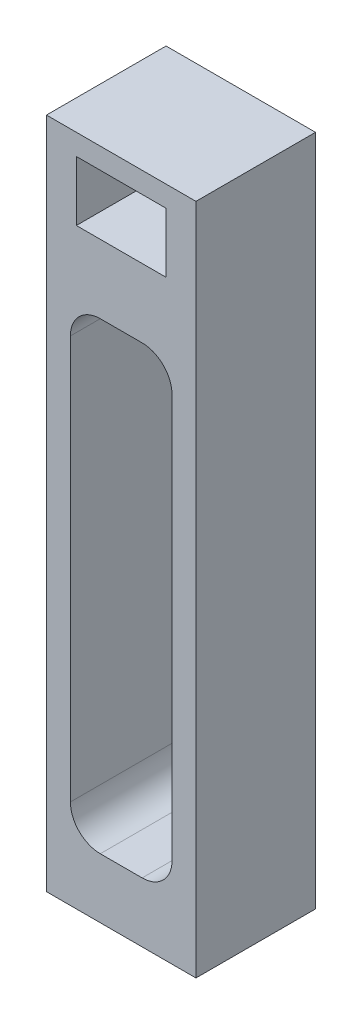
from build123d import *

# Parameters (mm, degrees)
BOSS_EXTRUDE1_DEPTH      = 100
BOSS_EXTRUDE1_DEPTH_BACK = 12.5
SKETCH1_W                = 25
SKETCH1_H                = 20
SKETCH2_W                = 15
SKETCH2_H                = 10
CUT_EXTRUDE1_DEPTH       = 103.74361294
CUT_EXTRUDE2_DEPTH       = 103.74361294


with BuildPart() as part:
    # Sketch1 → Boss-Extrude1 (new, two sides: drawn at the far end of the back side and taken through both)
    with BuildSketch(Plane(origin=(0, 0, 0), x_dir=(1, 0, 0), z_dir=(0, 1, 0)).offset(-BOSS_EXTRUDE1_DEPTH_BACK)):
        Rectangle(SKETCH1_W, SKETCH1_H)
    extrude(amount=BOSS_EXTRUDE1_DEPTH + BOSS_EXTRUDE1_DEPTH_BACK)

    # Sketch2 → Cut-Extrude1 (cut, through all)
    with BuildSketch(Plane.XY.offset(10)):
        with Locations((0, 91.5)):
            Rectangle(SKETCH2_W, SKETCH2_H)
    extrude(amount=-CUT_EXTRUDE1_DEPTH, mode=Mode.SUBTRACT)

    # Sketch3 → Cut-Extrude2 (cut, through all)
    with BuildSketch(Plane.XY.offset(10)):
        with BuildLine():
            Line((-3.5, -2.5), (3.5, -2.5))
            ThreePointArc((3.5, -2.5), (7.035533906, -1.035533906), (8.5, 2.5))
            Line((8.5, 2.5), (8.5, 70))
            ThreePointArc((8.5, 70), (7.035533906, 73.535533906), (3.5, 75))
            Line((3.5, 75), (-3.5, 75))
            ThreePointArc((-3.5, 75), (-7.035533906, 73.535533906), (-8.5, 70))
            Line((-8.5, 70), (-8.5, 2.5))
            ThreePointArc((-8.5, 2.5), (-7.035533906, -1.035533906), (-3.5, -2.5))
        make_face()
    extrude(amount=-CUT_EXTRUDE2_DEPTH, mode=Mode.SUBTRACT)


solid = part.part
